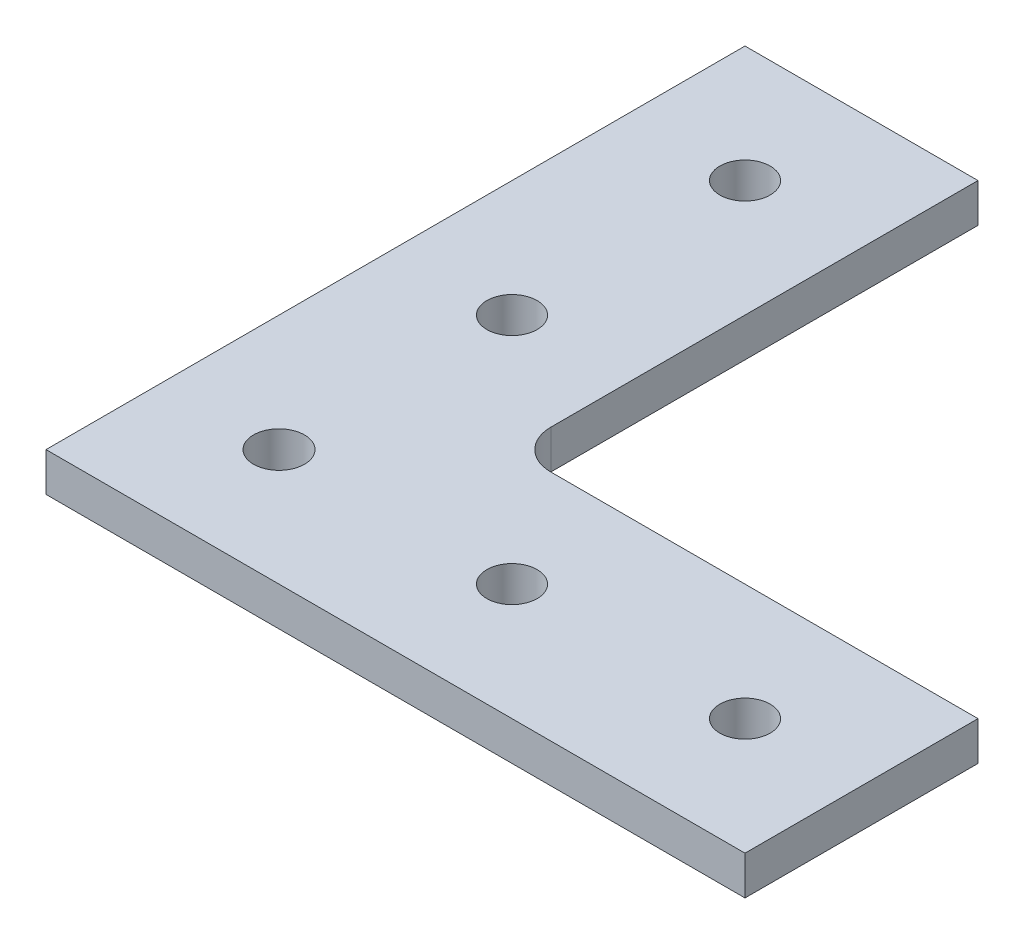
from build123d import *

# Parameters (mm, degrees)
SKETCH1_R           = 4.1656
SKETCH1_R_2         = 4.1148
BOSS_EXTRUDE1_DEPTH = 6.35


with BuildPart() as part:
    # Sketch1 → Boss-Extrude1 (new body)
    with BuildSketch(Plane(origin=(0, 0, 0), x_dir=(1, 0, 0), z_dir=(0, 1, 0))):
        with BuildLine():
            Line((-94.42173913, 44.607763975), (-94.42173913, -69.692236025))
            Line((-94.42173913, -69.692236025), (19.87826087, -69.692236025))
            Line((19.87826087, -69.692236025), (19.87826087, -31.592236025))
            Line((19.87826087, -31.592236025), (-49.97173913, -31.592236025))
            ThreePointArc((-49.97173913, -31.592236025), (-54.461867191, -29.732364085), (-56.32173913, -25.242236025))
            Line((-56.32173913, -25.242236025), (-56.32173913, 44.607763975))
            Line((-56.32173913, 44.607763975), (-94.42173913, 44.607763975))
        make_face()
        with Locations(Location((-75.37173913, -50.642236025, 0), (0, 0, 270))):
            Circle(SKETCH1_R, mode=Mode.SUBTRACT)
        with Locations(Location((0.82826087, -50.642236025, 0), (0, 0, 270))):
            Circle(SKETCH1_R_2, mode=Mode.SUBTRACT)
        with Locations(Location((-37.27173913, -50.642236025, 0), (0, 0, 270))):
            Circle(SKETCH1_R_2, mode=Mode.SUBTRACT)
        with Locations(Location((-75.37173913, 25.557763975, 0), (0, 0, 270))):
            Circle(SKETCH1_R_2, mode=Mode.SUBTRACT)
        with Locations(Location((-75.37173913, -12.542236025, 0), (0, 0, 270))):
            Circle(SKETCH1_R_2, mode=Mode.SUBTRACT)
    extrude(amount=BOSS_EXTRUDE1_DEPTH)


solid = part.part
